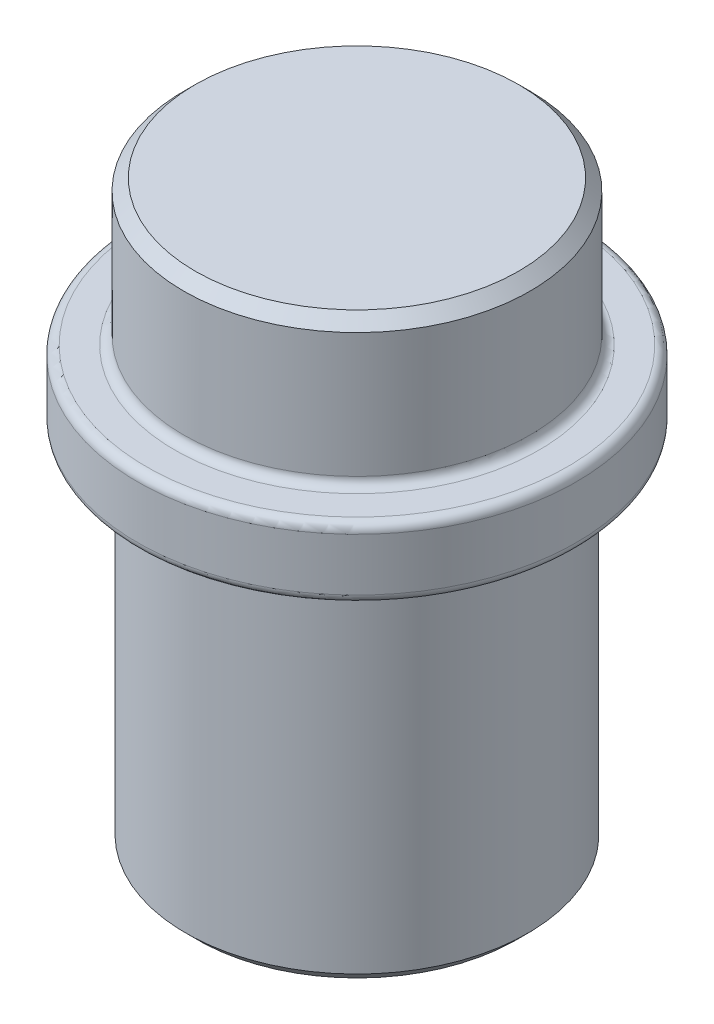
from build123d import *

# Parameters (mm, degrees)
EXT_LUG_DEPTH = 2.4892


with BuildPart() as part:
    # Sk_kingpin_section → Rev_kingpin (revolve)
    with BuildSketch(Plane.XY, mode=Mode.PRIVATE) as rev_kingpin_sk:
        with BuildLine():
            Line((0, 54.2544), (5.9944, 52.64912))
            Line((5.9944, 52.64912), (5.9944, 45.12818))
            Line((5.9944, 45.12818), (6.49478, 44.6278))
            Line((6.49478, 44.6278), (6.93928, 44.6278))
            Line((6.93928, 44.6278), (7.43839, 45.12818))
            Line((7.43839, 45.12818), (7.43839, 60.1218))
            ThreePointArc((7.43839, 60.1218), (7.549982316, 60.391207684), (7.81939, 60.5028))
            Line((7.81939, 60.5028), (9.1567, 60.5028))
            ThreePointArc((9.1567, 60.5028), (9.426107684, 60.614392316), (9.5377, 60.8838))
            Line((9.5377, 60.8838), (9.5377, 63.1698))
            ThreePointArc((9.5377, 63.1698), (9.426107684, 63.439207684), (9.1567, 63.5508))
            Line((9.1567, 63.5508), (7.9121, 63.5508))
            ThreePointArc((7.9121, 63.5508), (7.642692316, 63.662392316), (7.5311, 63.9318))
            Line((7.5311, 63.9318), (7.5311, 69.34962))
            Line((7.5311, 69.34962), (7.03072, 69.85))
            Line((7.03072, 69.85), (0, 69.85))
            Line((0, 69.85), (0, 54.2544))
        make_face()
    revolve(rev_kingpin_sk.sketch.rotate(Axis((0, -25.4, 0), (0, 1, 0)), 90), axis=Axis((0, -25.4, 0), (0, 1, 0)))

    # Sk_lug → Ext_lug (add)
    with BuildSketch(Plane(origin=(0, 63.5508, 0), x_dir=(1, 0, 0), z_dir=(0, 1, 0))):
        with BuildLine():
            Line((-7.19328, 2.23012), (-7.19328, -2.23012))
            ThreePointArc((-7.19328, -2.23012), (-7.46394509, -1.797883422), (-7.9121, -1.55448))
            ThreePointArc((-7.9121, -1.55448), (-9.1313, 0), (-7.9121, 1.55448))
            ThreePointArc((-7.9121, 1.55448), (-7.463342343, 1.797242155), (-7.19328, 2.23012))
        make_face()
    extrude(amount=EXT_LUG_DEPTH)


solid = part.part
